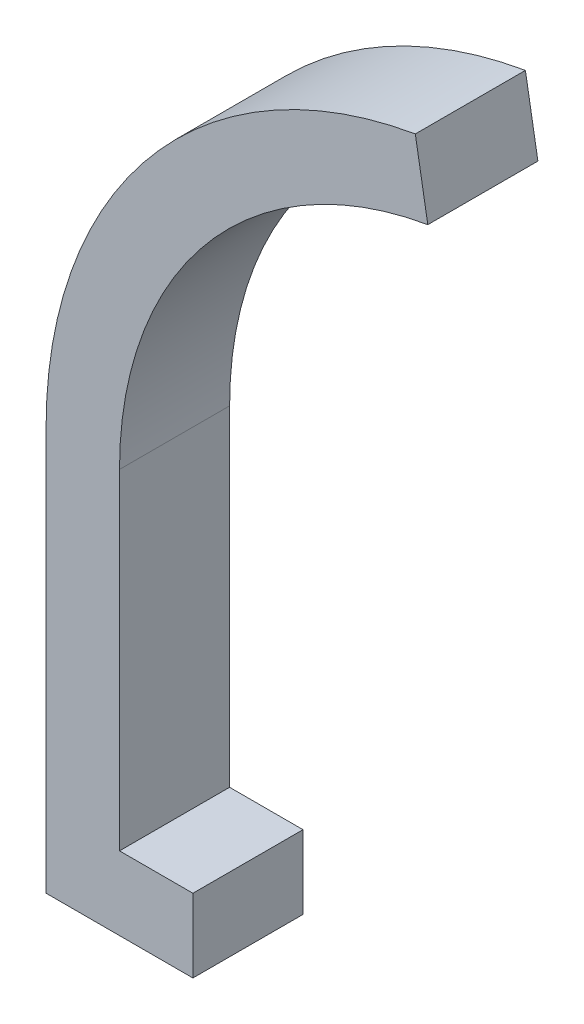
from build123d import *

# Parameters (mm, degrees)
BOSS_EXTRUDE1_DEPTH = 30


with BuildPart() as part:
    # Sketch1 → Boss-Extrude1 (new body)
    with BuildSketch(Plane.XY):
        with BuildLine():
            Line((-110, -20), (-90, -20))
            Line((-90, -20), (-90, -40))
            Line((-90, -40), (-130, -40))
            Line((-130, -40), (-130, 0))
            Line((-130, 0), (-130, 70))
            ThreePointArc((-130, 70), (-101.50137004, 148.087449405), (-29.404255319, 189.461689131))
            Line((-29.404255319, 189.461689131), (-26, 169.753542447))
            ThreePointArc((-26, 169.753542447), (-86.202920668, 135.205002168), (-110, 70))
            Line((-110, 70), (-110, 0))
            Line((-110, 0), (-110, -20))
        make_face()
    extrude(amount=BOSS_EXTRUDE1_DEPTH)


solid = part.part
